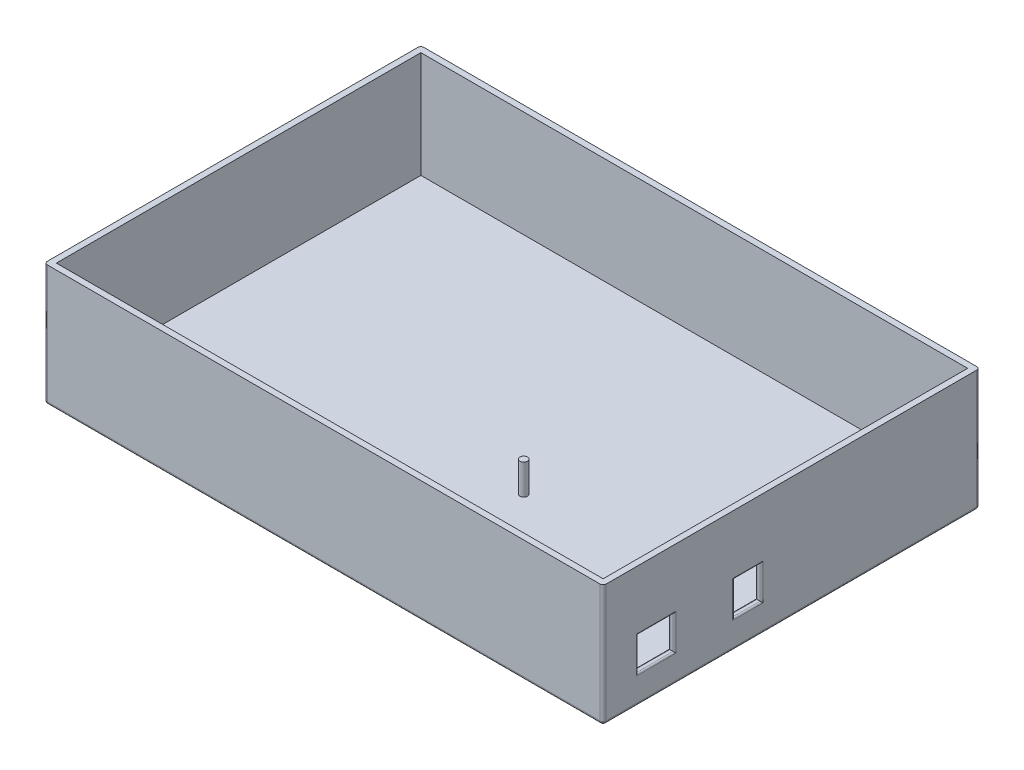
from build123d import *

# Parameters (mm, degrees)
IZIM2_W                     = 184
IZIM2_H                     = 124
Y_KSEKLIK_EKSTR_ZYON1_DEPTH = 40
IZIM3_W                     = 180
IZIM3_H                     = 120
KES_EKSTR_ZYON1_DEPTH       = 35
KES_EKSTR_ZYON3_DEPTH       = 100
KES_EKSTR_ZYON3_DEPTH_BACK  = 57
IZIM9_W                     = 12
IZIM9_H                     = 11
IZIM9_W_2                   = 9
IZIM10_R                    = 1.225
Y_KSEKLIK_EKSTR_ZYON2_DEPTH = 10
RADYUS1_R                   = 1
RADYUS2_R                   = 0.5


with BuildPart() as part:
    # Çizim2 → Yükseklik-Ekstrüzyon1 (new body)
    with BuildSketch(Plane(origin=(0, 0, 0), x_dir=(1, 0, 0), z_dir=(0, 1, 0))):
        Rectangle(IZIM2_W, IZIM2_H)
    extrude(amount=Y_KSEKLIK_EKSTR_ZYON1_DEPTH)

    # Çizim3 → Kes-Ekstrüzyon1 (cut)
    with BuildSketch(Plane(origin=(0, 40, 0), x_dir=(1, 0, 0), z_dir=(0, 1, 0))):
        Rectangle(IZIM3_W, IZIM3_H)
    extrude(amount=-KES_EKSTR_ZYON1_DEPTH, mode=Mode.SUBTRACT)

    # Çizim9 → Kes-Ekstrüzyon3 (cut, two sides: drawn at the far end of the back side and taken through both)
    with BuildSketch(Plane(origin=(92, 0, 0), x_dir=(0, 0, -1), z_dir=(1, 0, 0)).offset(-KES_EKSTR_ZYON3_DEPTH_BACK)):
        with Locations((-44.5, 14.8)):
            Rectangle(IZIM9_W, IZIM9_H)
        with Locations((-14.35, 14.8)):
            Rectangle(IZIM9_W_2, IZIM9_H)
    extrude(amount=KES_EKSTR_ZYON3_DEPTH + KES_EKSTR_ZYON3_DEPTH_BACK, mode=Mode.SUBTRACT)

    # Çizim10 → Yükseklik-Ekstrüzyon2 (add)
    with BuildSketch(Plane(origin=(0, 5, 0), x_dir=(1, 0, 0), z_dir=(0, 1, 0))):
        with Locations(Location((70, -8.75, 0), (0, 0, 90))):
            Circle(IZIM10_R)
        with Locations(Location((68.6, -57.05, 0), (0, 0, 90))):
            Circle(IZIM10_R)
        with Locations(Location((17.84, -41.9, 0), (0, 0, 90))):
            Circle(IZIM10_R)
        with Locations(Location((17.81, -13.95, 0), (0, 0, 90))):
            Circle(IZIM10_R)
    extrude(amount=Y_KSEKLIK_EKSTR_ZYON2_DEPTH)

    # Radyus1
    radyus1_edges = [part.edges().sort_by_distance(p)[0] for p in [
        (-92, 0, 0),
        (0, 0, 62),
        (92, 0, 0),
        (0, 0, -62),
        (-92, 20, -62),
        (-92, 20, 62),
        (92, 20, 62),
        (92, 20, -62),
    ]]
    fillet(radyus1_edges, radius=RADYUS1_R)

    # Radyus2
    radyus2_edges = [part.edges().sort_by_distance(p)[0] for p in [
        (90, 20.3, 44.5),
        (90, 14.8, 38.5),
        (90, 9.3, 44.5),
        (90, 14.8, 50.5),
        (90, 20.3, 14.35),
        (90, 14.8, 9.85),
        (90, 9.3, 14.35),
        (90, 14.8, 18.85),
        (92, 14.8, 18.85),
        (92, 9.3, 14.35),
        (92, 14.8, 9.85),
        (92, 20.3, 14.35),
        (92, 14.8, 50.5),
        (92, 9.3, 44.5),
        (92, 14.8, 38.5),
        (92, 20.3, 44.5),
    ]]
    fillet(radyus2_edges, radius=RADYUS2_R)


solid = part.part
